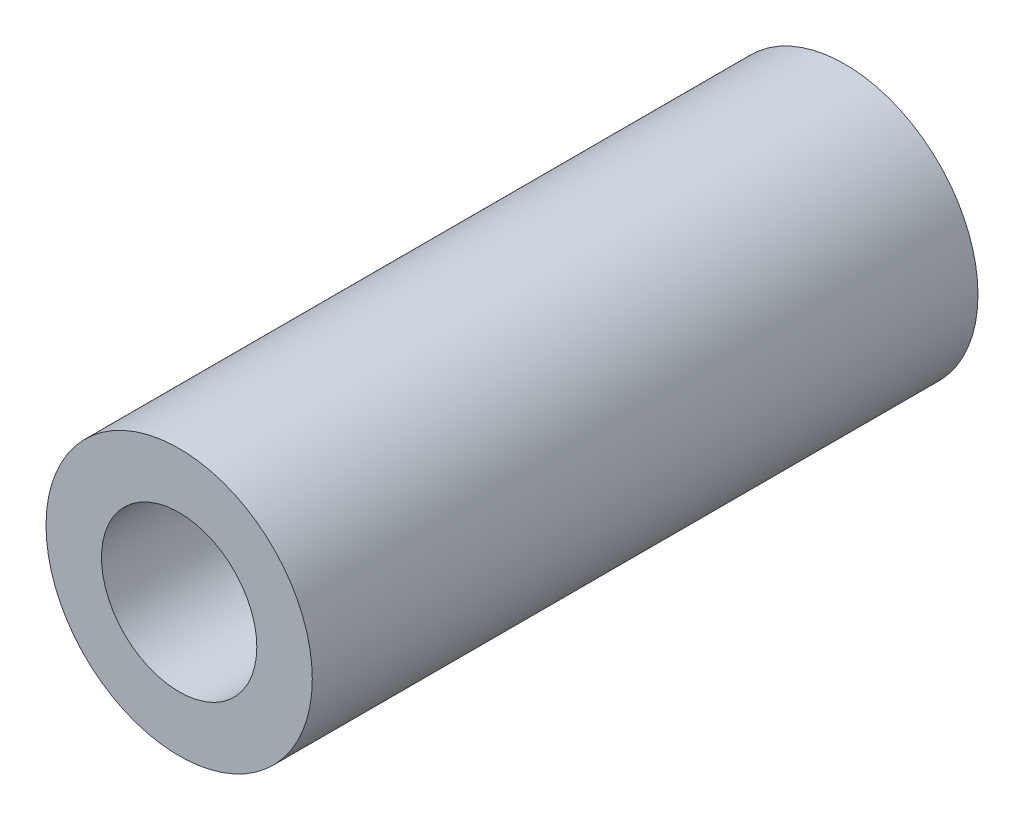
from build123d import *

# Parameters (mm, degrees)
SKETCH1_W = 0.833333333
SKETCH1_H = 10


with BuildPart() as part:
    # Sketch1 → Revolve1 (revolve)
    with BuildSketch(Plane(origin=(0, 0.806470296, 0), x_dir=(1, 0, 0), z_dir=(0, 1, 0))):
        with Locations((2.721142694, -5)):
            Rectangle(SKETCH1_W, SKETCH1_H)
    revolve(axis=Axis((1.13780936, 0.806470296, 0), (0, 0, 1)))


solid = part.part
